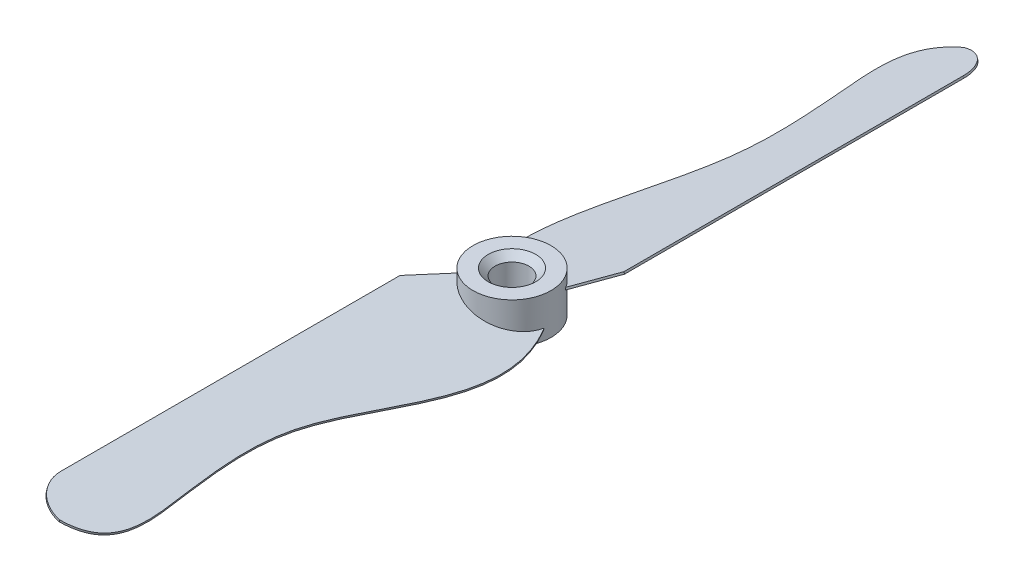
from build123d import *

# Parameters (mm, degrees)
SKETCH1_R           = 5.75
BOSS_EXTRUDE1_DEPTH = 3
BOSS_EXTRUDE2_DEPTH = 0.15
CIRPATTERN1_COUNT   = 2
SKETCH4_R           = 2.5
CUT_EXTRUDE1_DEPTH  = 65.293804857
CHAMFER1_SIZE       = 1
SCALE1_SCALE        = 0.8


with BuildPart() as part:
    # Sketch1 → Boss-Extrude1 (new, symmetric)
    with BuildSketch(Plane(origin=(0, 0, 0), x_dir=(1, 0, 0), z_dir=(0, 1, 0))):
        with Locations(Location((0, 0, 0), (0, 0, 270))):
            Circle(SKETCH1_R)
    extrude(amount=BOSS_EXTRUDE1_DEPTH, both=True)

    # Sketch3 → Boss-Extrude2 (add, symmetric)
    with BuildSketch(Plane(origin=(0, 0, 0), x_dir=(0.9659258262890681, -0.25881904510252135, 0), z_dir=(-0.25881904510252135, -0.9659258262890681, 0))):
        with BuildLine():
            Line((-4.839914139, 2.623745504), (-8.334886543, 8.5))
            Line((-8.334886543, 8.5), (-8.334886543, 58.5))
            ThreePointArc((-8.334886543, 58.5), (-6.870420449, 62.035533906), (-3.334886543, 63.5))
            add(Edge.make_bspline(
                [(5.746982113, 0.761996319), (12.131355978, 11.850018821), (-0.936182392, 28.084027466), (1.461879649, 49.536058165), (2.906134653, 61.805968839), (-3.334886543, 63.5)],
                knots=[0, 0, 0, 0, 0.512789376, 0.775226186, 1, 1, 1, 1], degree=3))
            add(Edge.make_bspline(
                [(-4.839914139, 2.623745504), (-4.099694998, 4.029932723), (-0.024977129, 7.494277123), (5.216231685, 3.583159529), (5.746982113, 0.761996319)],
                knots=[0, 0, 0, 0, 0.356037784, 1, 1, 1, 1], degree=3))
        make_face()
    boss_extrude2 = extrude(amount=BOSS_EXTRUDE2_DEPTH, both=True)

    # CirPattern1: Boss-Extrude2 ×2 about axis
    cirpattern1_axis = Axis((0, 3, 0), (0, -1, 0))
    for i in range(1, CIRPATTERN1_COUNT):
        add(boss_extrude2.rotate(cirpattern1_axis, i * 360 / CIRPATTERN1_COUNT))

    # Sketch4 → Cut-Extrude1 (cut, through all)
    with BuildSketch(Plane.XZ.offset(3)):
        with Locations(Location((0, 0, 0), (0, 0, 270))):
            Circle(SKETCH4_R)
    extrude(amount=-CUT_EXTRUDE1_DEPTH, mode=Mode.SUBTRACT)

    # Chamfer1
    chamfer1_edges = [part.edges().sort_by_distance(p)[0] for p in [
        (0, 3, 2.5),
        (0, -3, 2.5),
    ]]
    chamfer(chamfer1_edges, length=CHAMFER1_SIZE)


with BuildPart() as part_1:
    # Scale1: scaled about (3.49e-07, 0.242843854, 1.5359e-05)
    add(part.part.scale(SCALE1_SCALE).moved(Location((7e-08, 0.048568771, 3.072e-06))))


solid = part_1.part
